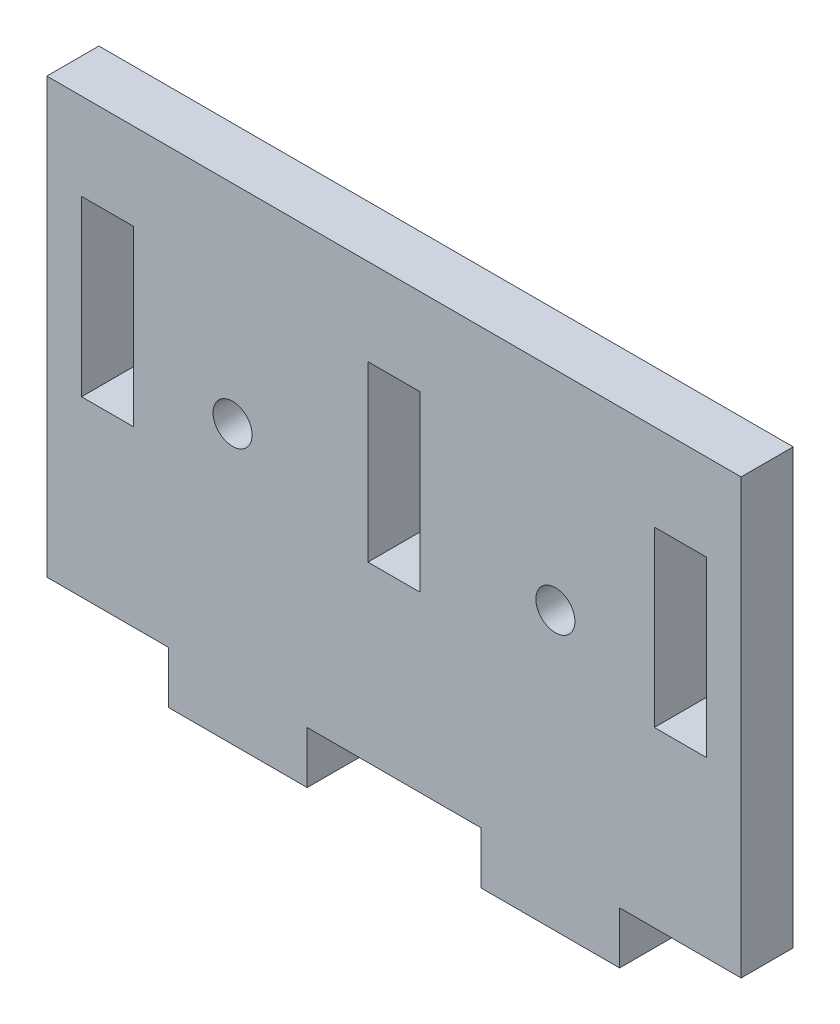
from build123d import *

# Parameters (mm, degrees)
SKETCH_1_R      = 1.125
SKETCH_1_W      = 3
SKETCH_1_H      = 10
EXTRUDE_1_DEPTH = 3


with BuildPart() as part:
    # 草图1 → 凸台-拉伸1 (new body)
    with BuildSketch(Plane.XY):
        Polygon((40, 0), (40, 25), (0, 25), (0, 0), (2, 0), (5, 0), (7, 0), (7, -3), (15, -3), (15, 0), (25, 0), (25, -3), (33, -3), (33, 0), (35, 0), (38, 0), align=None)
        with Locations((10.7, 13)):
            Circle(SKETCH_1_R, mode=Mode.SUBTRACT)
        with Locations((29.3, 13)):
            Circle(SKETCH_1_R, mode=Mode.SUBTRACT)
        with Locations((3.5, 15)):
            Rectangle(SKETCH_1_W, SKETCH_1_H, mode=Mode.SUBTRACT)
        with Locations((36.5, 15)):
            Rectangle(SKETCH_1_W, SKETCH_1_H, mode=Mode.SUBTRACT)
        with Locations((20, 15)):
            Rectangle(SKETCH_1_W, SKETCH_1_H, mode=Mode.SUBTRACT)
    extrude(amount=EXTRUDE_1_DEPTH)


solid = part.part
